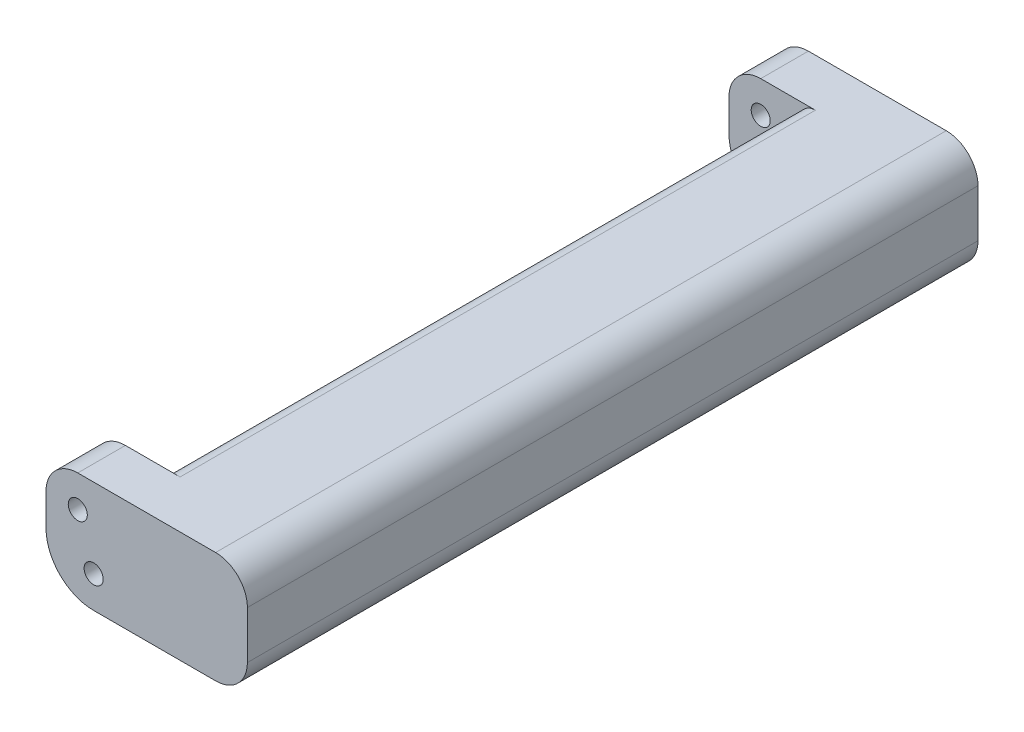
from build123d import *

# Parameters (mm, degrees)
SKETCH1_W           = 40.259
SKETCH1_H           = 25.4
SKETCH1_R           = 1.905
BOSS_EXTRUDE1_DEPTH = 9.525
BOSS_EXTRUDE2_DEPTH = 127
SKETCH3_R           = 1.905
BOSS_EXTRUDE3_DEPTH = 9.525
FILLET2_R           = 6.35
FILLET3_R           = 3.175
CUT_EXTRUDE1_REACH  = 153.604
SKETCH4_W           = 40.259
SKETCH4_H           = 3.175
FILLET4_R           = 9.525
FILLET6_R           = 6.35


with BuildPart() as part:
    # Sketch1 → Boss-Extrude1 (new body)
    with BuildSketch(Plane.XY):
        with Locations((-11.6205, 12.7)):
            Rectangle(SKETCH1_W, SKETCH1_H)
        with Locations(Location((-22.225, 9.525, 0), (0, 0, 180))):
            Circle(SKETCH1_R, mode=Mode.SUBTRACT)
        with Locations(Location((-25.4, 19.05, 0), (0, 0, 180))):
            Circle(SKETCH1_R, mode=Mode.SUBTRACT)
    extrude(amount=BOSS_EXTRUDE1_DEPTH)

    # Sketch2 → Boss-Extrude2 (add)
    with BuildSketch(Plane.XY.offset(9.525)):
        Polygon((-19.05, 25.4), (-9.525, 0), (8.509, 0), (8.509, 25.4), align=None)
    extrude(amount=BOSS_EXTRUDE2_DEPTH)

    # Sketch3 → Boss-Extrude3 (add)
    with BuildSketch(Plane.XY.offset(136.525)):
        Polygon((8.509, 25.4), (-19.05, 25.4), (-31.75, 25.4), (-31.75, 0), (-9.525, 0), (8.509, 0), align=None)
        with Locations(Location((-25.4, 19.05, 0), (0, 0, 180))):
            Circle(SKETCH3_R, mode=Mode.SUBTRACT)
        with Locations(Location((-22.225, 9.525, 0), (0, 0, 180))):
            Circle(SKETCH3_R, mode=Mode.SUBTRACT)
    extrude(amount=BOSS_EXTRUDE3_DEPTH)

    # Fillet2
    fillet2_edges = [part.edges().sort_by_distance(p)[0] for p in [
        (-31.75, 25.4, 4.7625),
        (8.509, 25.4, 73.025),
        (-31.75, 25.4, 141.2875),
    ]]
    fillet(fillet2_edges, radius=FILLET2_R)

    # Fillet3
    fillet3_edges = [part.edges().sort_by_distance(p)[0] for p in [
        (-19.05, 25.4, 73.025),
    ]]
    fillet(fillet3_edges, radius=FILLET3_R)

    # Cut-Extrude1: up to this face of the body (flat: up to its plane)
    cut_extrude1_end = Plane(part.part.faces().sort_by_distance((-11.337539772, 12.464426548, 0))[0])
    # Sketch4 → Cut-Extrude1 (cut, up to the picked face)
    with BuildSketch(Plane.XY.offset(146.05), mode=Mode.PRIVATE) as cut_extrude1_sk1:
        with Locations((-11.6205, 1.5875)):
            Rectangle(SKETCH4_W, SKETCH4_H)
    cut_extrude1_tool1 = split(extrude(cut_extrude1_sk1.sketch, amount=-CUT_EXTRUDE1_REACH, mode=Mode.PRIVATE), bisect_by=cut_extrude1_end, keep=Keep.BOTH, mode=Mode.PRIVATE)
    add(cut_extrude1_tool1.solids().sort_by(Axis((-11.6205, 1.5875, 146.05), (0, 0, -1)))[0], mode=Mode.SUBTRACT)

    # Fillet4
    fillet4_edges = [part.edges().sort_by_distance(p)[0] for p in [
        (-31.75, 3.175, 141.2875),
        (-31.75, 3.175, 4.7625),
    ]]
    fillet(fillet4_edges, radius=FILLET4_R)

    # Fillet6
    fillet6_edges = [part.edges().sort_by_distance(p)[0] for p in [
        (8.509, 3.175, 73.025),
    ]]
    fillet(fillet6_edges, radius=FILLET6_R)


solid = part.part
